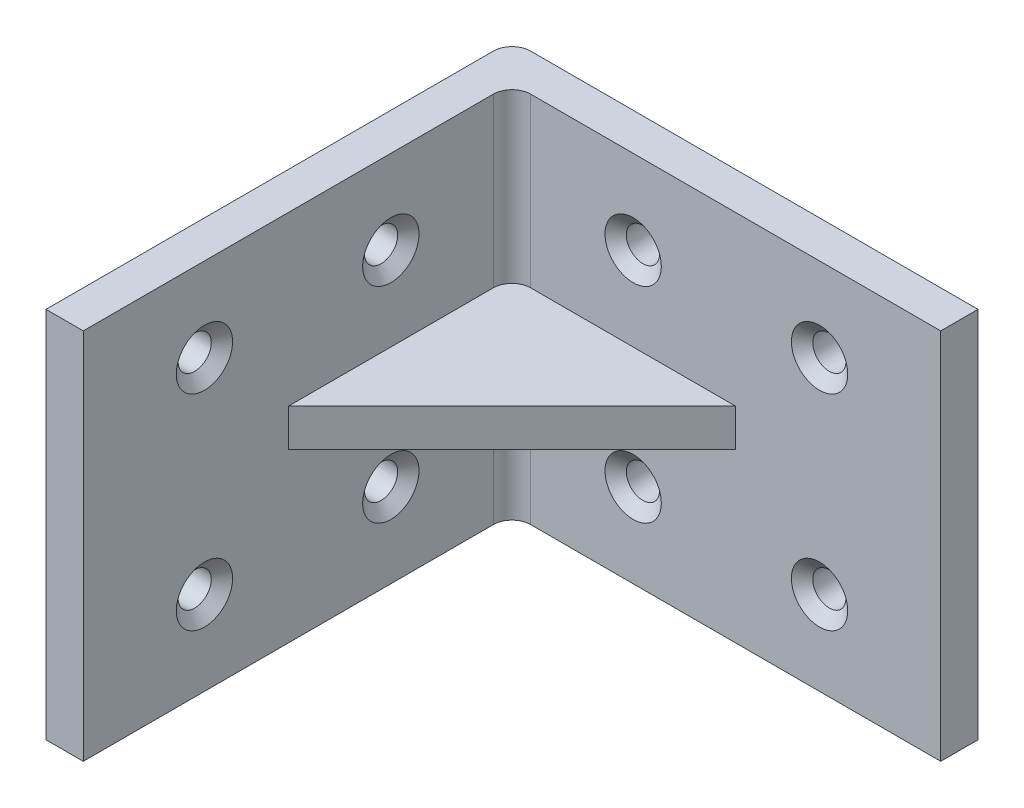
from build123d import *

# Parameters (mm, degrees)
SKETCH1_W                                 = 25
SKETCH1_H                                 = 20
BOSS_EXTRUDE1_DEPTH                       = 2
SKETCH2_W                                 = 2
SKETCH2_H                                 = 20
BOSS_EXTRUDE2_DEPTH                       = 23
FILLET2_R                                 = 1
FILLET3_R                                 = 1
RIB1_REACH                                = 94.888
SKETCH4_WALL_W                            = 204.746879862
SKETCH4_WALL_H                            = 2
CSK_FOR_0_FLAT_HEAD_MACHINE_SCREW_2_COUNT = 2
CSK_FOR_0_FLAT_HEAD_MACHINE_SCREW_2_PITCH = 10


with BuildPart() as part:
    # Sketch1 → Boss-Extrude1 (new body)
    with BuildSketch(Plane.XY):
        with Locations((-76.4, 19.882401427)):
            Rectangle(SKETCH1_W, SKETCH1_H)
    extrude(amount=BOSS_EXTRUDE1_DEPTH)

    # Sketch2 → Boss-Extrude2 (add)
    with BuildSketch(Plane.XY.offset(2)):
        with Locations((-87.9, 19.882401427)):
            Rectangle(SKETCH2_W, SKETCH2_H)
    extrude(amount=BOSS_EXTRUDE2_DEPTH)

    # Fillet2
    fillet2_edges = [part.edges().sort_by_distance(p)[0] for p in [
        (-86.9, 19.882401427, 2),
    ]]
    fillet(fillet2_edges, radius=FILLET2_R)

    # Fillet3
    fillet3_edges = [part.edges().sort_by_distance(p)[0] for p in [
        (-88.9, 19.882401427, 0),
    ]]
    fillet(fillet3_edges, radius=FILLET3_R)

    # Sketch4 wall → Rib1 (add, up to next)
    with BuildSketch(Plane(origin=(-80.9, 19.882401427, 8), x_dir=(0.707106781187, 0, -0.707106781187), z_dir=(0.707106781187, 0, 0.707106781187)), mode=Mode.PRIVATE) as rib1_sk1:
        Rectangle(SKETCH4_WALL_W, SKETCH4_WALL_H)
    rib1_tool1 = extrude(rib1_sk1.sketch, amount=-RIB1_REACH, mode=Mode.PRIVATE) - part.part
    add(rib1_tool1.solids().sort_by_distance((-80.9, 19.882401427, 8))[0])

    # Sketch5 → CSK for #0 Flat Head Machine Screw (100)1 (revolve, cut)
    with BuildSketch(Plane(origin=(-80.4, 14.382401427, 2), x_dir=(0, -1, 0), z_dir=(1, 0, 0))):
        Polygon((0, 0), (0, 10.53416509), (0.889, 10), (0.889, 0.5221717), (1.5113, 0), align=None)
    csk_for_0_flat_head_machine_screw_100 = revolve(axis=Axis((-80.4, 14.382401427, 8.35), (0, 0, -1)), mode=Mode.SUBTRACT)

    # CSK for _0 Flat Head Machine Screw _ 2: CSK for #0 Flat Head Machine Screw (100)1 ×2
    with Locations(*[(i * CSK_FOR_0_FLAT_HEAD_MACHINE_SCREW_2_PITCH, 0, 0) for i in range(1, CSK_FOR_0_FLAT_HEAD_MACHINE_SCREW_2_COUNT)]):
        add(csk_for_0_flat_head_machine_screw_100, mode=Mode.SUBTRACT)

    # Mirror1: CSK for #0 Flat Head Machine Screw (100)1 across plane
    add(csk_for_0_flat_head_machine_screw_100.mirror(Plane(origin=(0, 19.882401427, 0), x_dir=(0, 0, 1), z_dir=(0, -1, 0))), mode=Mode.SUBTRACT)

    # Mirror1 copy 1 sketch → Mirror1 copy 1 (revolve, cut)
    with BuildSketch(Plane(origin=(-70.4, 25.382401427, 2), x_dir=(0, 1, 0), z_dir=(1, 0, 0))):
        Polygon((0, 0), (0, -10.53416509), (0.889, -10), (0.889, -0.5221717), (1.5113, 0), align=None)
    revolve(axis=Axis((-70.4, 25.382401427, 8.35), (0, 0, 1)), mode=Mode.SUBTRACT)

    # Mirror2: CSK for #0 Flat Head Machine Screw (100)1 across plane
    add(csk_for_0_flat_head_machine_screw_100.mirror(Plane(origin=(-44.45, 0, 44.45), x_dir=(0.7071067811865481, 2.453269466693398e-15, 0.707106781186547), z_dir=(0.7071067811865471, 2.4532694666933947e-15, -0.707106781186548))), mode=Mode.SUBTRACT)

    # Mirror2 copy 1 sketch → Mirror2 copy 1 (revolve, cut)
    with BuildSketch(Plane(origin=(-86.9, 14.382401427, 18.5), x_dir=(0, -1, 0), z_dir=(0, 0, 1))):
        Polygon((0, 0), (0, -10.53416509), (0.889, -10), (0.889, -0.5221717), (1.5113, 0), align=None)
    revolve(axis=Axis((-80.55, 14.382401427, 18.5), (1, 0, 0)), mode=Mode.SUBTRACT)

    # Mirror2 copy 2 sketch → Mirror2 copy 2 (revolve, cut)
    with BuildSketch(Plane(origin=(-86.9, 25.382401427, 8.5), x_dir=(0, 1, 0), z_dir=(0, 0, 1))):
        Polygon((0, 0), (0, 10.53416509), (0.889, 10), (0.889, 0.5221717), (1.5113, 0), align=None)
    revolve(axis=Axis((-80.55, 25.382401427, 8.5), (-1, 0, 0)), mode=Mode.SUBTRACT)

    # Mirror2 copy 3 sketch → Mirror2 copy 3 (revolve, cut)
    with BuildSketch(Plane(origin=(-86.9, 25.382401427, 18.5), x_dir=(0, 1, 0), z_dir=(0, 0, 1))):
        Polygon((0, 0), (0, 10.53416509), (0.889, 10), (0.889, 0.5221717), (1.5113, 0), align=None)
    revolve(axis=Axis((-80.55, 25.382401427, 18.5), (-1, 0, 0)), mode=Mode.SUBTRACT)


solid = part.part
